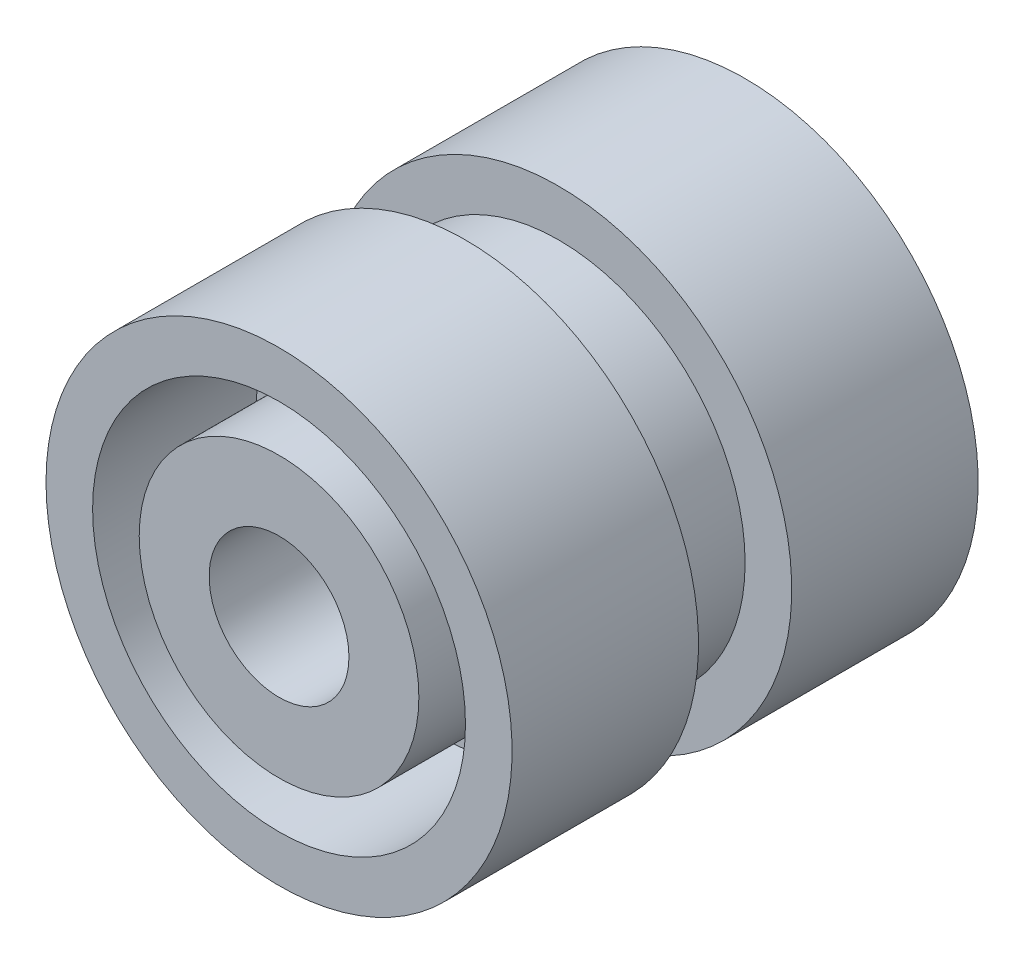
from build123d import *

# Parameters (mm, degrees)
BOSS_EXTRUDE1_DEPTH = 2
SKETCH4_R           = 1.5
CUT_EXTRUDE1_DEPTH  = 8


with BuildPart() as part:
    # Sketch2 → Revolve1 (revolve)
    with BuildSketch(Plane(origin=(0, 0, 0), x_dir=(0, 0, -1), z_dir=(1, 0, 0)), mode=Mode.PRIVATE) as revolve1_sk:
        Polygon((0, 0), (-5, 0), (-5, 3), (-1.5, 3), (-1.5, 4), (-5, 4), (-5, 5), (-1, 5), (-1, 4), (1, 4), (1, 5), (5, 5), (5, 4), (1.5, 4), (1.5, 0), align=None)
    revolve(revolve1_sk.sketch.rotate(Axis((0, 0, 0), (0, 0, 1)), 90), axis=Axis((0, 0, 0), (0, 0, 1)))

    # Sketch3 → Boss-Extrude1 (add)
    with BuildSketch(Plane(origin=(0, 0, -1.5), x_dir=(-1, 0, 0), z_dir=(0, 0, -1))):
        with BuildLine():
            Line((0.5, 1.936491673), (0.5, 3.968626967))
            ThreePointArc((0.5, 3.968626967), (0, 4), (-0.5, 3.968626967))
            Line((-0.5, 3.968626967), (-0.5, 1.936491673))
            ThreePointArc((-0.5, 1.936491673), (-1.414213562, 1.414213562), (-1.936491673, 0.5))
            Line((-1.936491673, 0.5), (-3.968626967, 0.5))
            ThreePointArc((-3.968626967, 0.5), (-4, 0), (-3.968626967, -0.5))
            Line((-3.968626967, -0.5), (-1.936491673, -0.5))
            ThreePointArc((-1.936491673, -0.5), (-1.414213562, -1.414213562), (-0.5, -1.936491673))
            Line((-0.5, -1.936491673), (-0.5, -3.968626967))
            ThreePointArc((-0.5, -3.968626967), (0, -4), (0.5, -3.968626967))
            Line((0.5, -3.968626967), (0.5, -1.936491673))
            ThreePointArc((0.5, -1.936491673), (1.414213562, -1.414213562), (1.936491673, -0.5))
            Line((1.936491673, -0.5), (3.968626967, -0.5))
            ThreePointArc((3.968626967, -0.5), (4, 0), (3.968626967, 0.5))
            Line((3.968626967, 0.5), (1.936491673, 0.5))
            ThreePointArc((1.936491673, 0.5), (1.414213562, 1.414213562), (0.5, 1.936491673))
        make_face()
    extrude(amount=BOSS_EXTRUDE1_DEPTH)

    # Sketch4 → Cut-Extrude1 (cut)
    with BuildSketch(Plane.XY.offset(5)):
        Circle(SKETCH4_R)
    extrude(amount=-CUT_EXTRUDE1_DEPTH, mode=Mode.SUBTRACT)


solid = part.part
